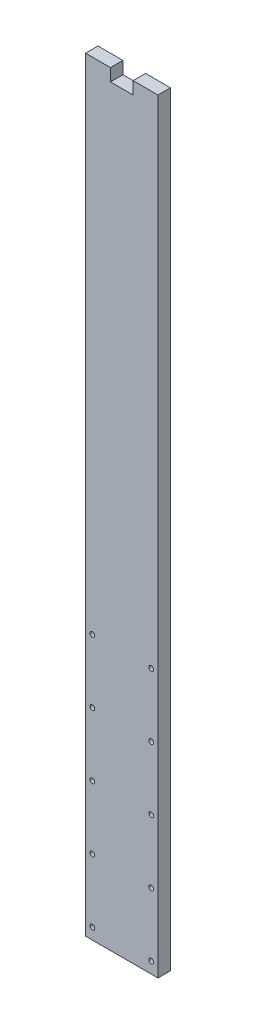
from build123d import *

# Parameters (mm, degrees)
SKETCH_1_W          = 32
SKETCH_1_H          = 338
EXTRUDE_1_DEPTH     = 5.5
SKETCH_2_W          = 10
SKETCH_2_H          = 5.5
CUT_EXTRUDE_1_DEPTH = 5.5
SKETCH_3_R          = 1.05
CUT_EXTRUDE_2_DEPTH = 10


with BuildPart() as part:
    # ｽｹｯﾁ1 → ﾎﾞｽ - 押し出し1 (new body)
    with BuildSketch(Plane.XY):
        with Locations((16, 169)):
            Rectangle(SKETCH_1_W, SKETCH_1_H)
    extrude(amount=EXTRUDE_1_DEPTH)

    # ｽｹｯﾁ2 → ｶｯﾄ - 押し出し1 (cut)
    with BuildSketch(Plane.XY.offset(5.5)):
        with Locations((16, 335.25)):
            Rectangle(SKETCH_2_W, SKETCH_2_H)
    extrude(amount=-CUT_EXTRUDE_1_DEPTH, mode=Mode.SUBTRACT)

    # ｽｹｯﾁ3 → ｶｯﾄ - 押し出し2 (cut)
    with BuildSketch(Plane.XY.offset(5.5)):
        with Locations((3, 5)):
            Circle(SKETCH_3_R)
        with Locations((29, 5)):
            Circle(SKETCH_3_R)
        with Locations((3, 33)):
            Circle(SKETCH_3_R)
        with Locations((29, 33)):
            Circle(SKETCH_3_R)
        with Locations((3, 61)):
            Circle(SKETCH_3_R)
        with Locations((29, 61)):
            Circle(SKETCH_3_R)
        with Locations((3, 89)):
            Circle(SKETCH_3_R)
        with Locations((29, 89)):
            Circle(SKETCH_3_R)
        with Locations((3, 117)):
            Circle(SKETCH_3_R)
        with Locations((29, 117)):
            Circle(SKETCH_3_R)
    extrude(amount=-CUT_EXTRUDE_2_DEPTH, mode=Mode.SUBTRACT)


solid = part.part
